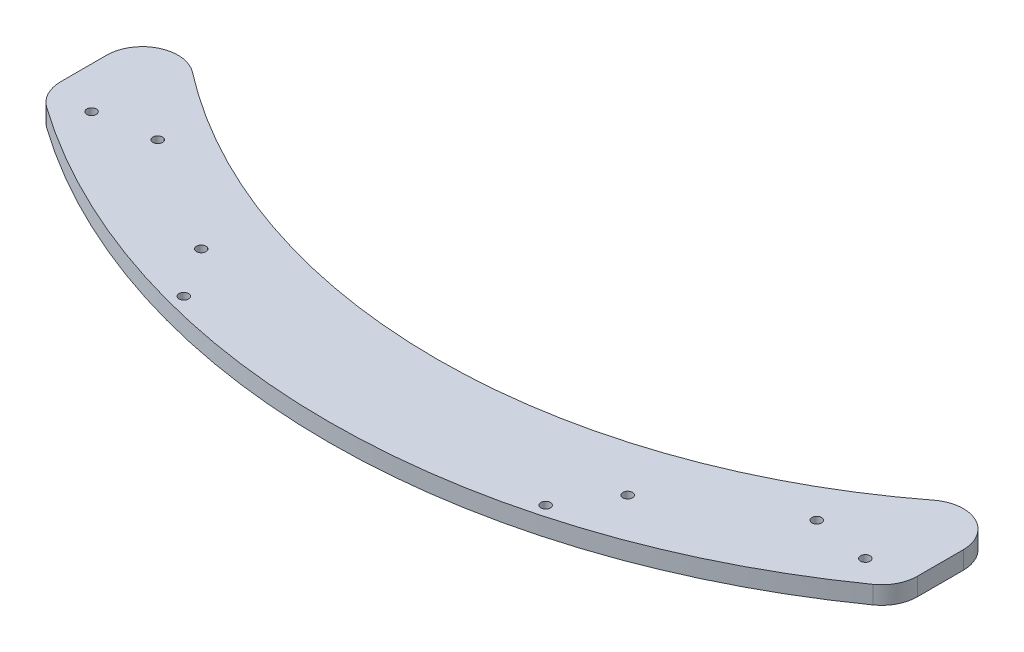
from build123d import *

# Parameters (mm, degrees)
SKETCH1_R           = 1.70053
BOSS_EXTRUDE1_DEPTH = 6.35


with BuildPart() as part:
    # Sketch1 → Boss-Extrude1 (new body)
    with BuildSketch(Plane(origin=(0, 0, 0), x_dir=(1, 0, 0), z_dir=(0, 1, 0))):
        with BuildLine():
            Line((152.4, -78.951070218), (152.4, -95.294257863))
            ThreePointArc((152.4, -95.294257863), (150.97868492, -101.132174142), (147.03287142, -105.663394603))
            ThreePointArc((147.03287142, -105.663394603), (0, -152.4), (-147.03287142, -105.663394603))
            ThreePointArc((-147.03287142, -105.663394603), (-150.97868492, -101.132174142), (-152.4, -95.294257863))
            Line((-152.4, -95.294257863), (-152.4, -78.951070218))
            ThreePointArc((-152.4, -78.951070218), (-145.304042262, -67.554372875), (-131.945714909, -68.893184619))
            ThreePointArc((-131.945714909, -68.893184619), (0, -113.850994317), (131.945714909, -68.893184619))
            ThreePointArc((131.945714909, -68.893184619), (145.304042262, -67.554372875), (152.4, -78.951070218))
        make_face()
        with Locations(Location((117.248460029, -95.925846163, 0), (0, 0, 270))):
            Circle(SKETCH1_R, mode=Mode.SUBTRACT)
        with Locations(Location((137.667738303, -99.066982467, 0), (0, 0, 270))):
            Circle(SKETCH1_R, mode=Mode.SUBTRACT)
        with Locations(Location((75.867733859, -121.822498113, 0), (0, 0, 270))):
            Circle(SKETCH1_R, mode=Mode.SUBTRACT)
        with Locations(Location((64.373888493, -139.521467891, 0), (0, 0, 270))):
            Circle(SKETCH1_R, mode=Mode.SUBTRACT)
        with Locations(Location((-117.248460029, -95.925846163, 0), (0, 0, 90))):
            Circle(SKETCH1_R, mode=Mode.SUBTRACT)
        with Locations(Location((-137.667738303, -99.066982467, 0), (0, 0, 90))):
            Circle(SKETCH1_R, mode=Mode.SUBTRACT)
        with Locations(Location((-64.373888493, -139.521467891, 0), (0, 0, 90))):
            Circle(SKETCH1_R, mode=Mode.SUBTRACT)
        with Locations(Location((-75.867733859, -121.822498113, 0), (0, 0, 90))):
            Circle(SKETCH1_R, mode=Mode.SUBTRACT)
    extrude(amount=BOSS_EXTRUDE1_DEPTH)


solid = part.part
